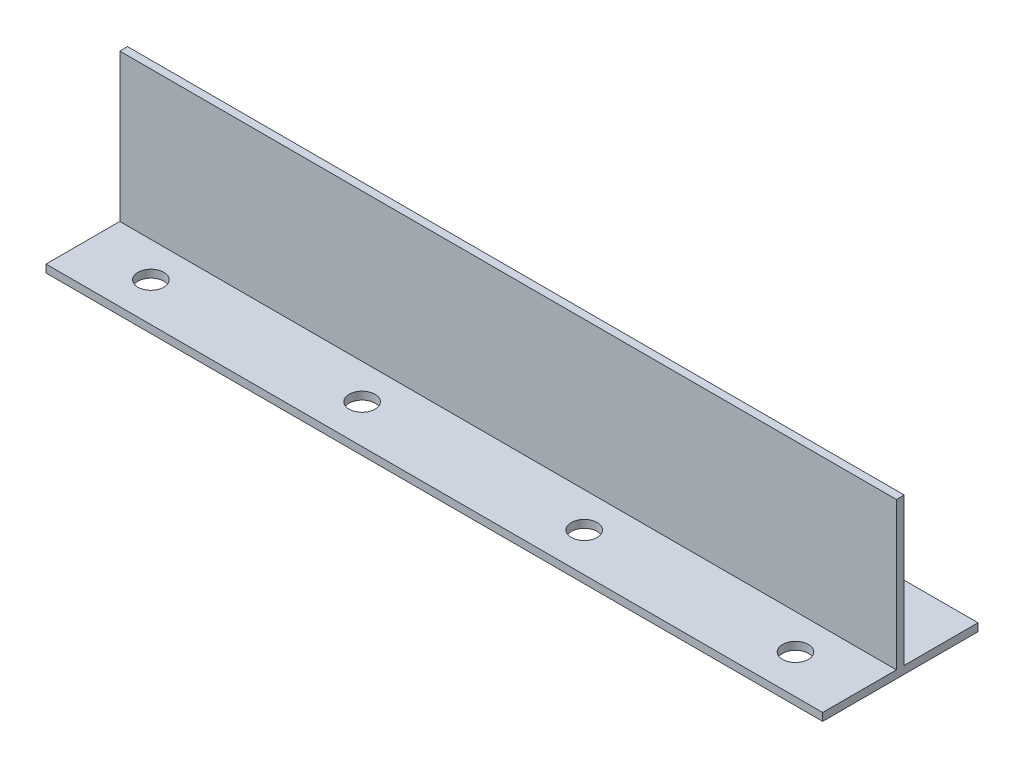
from build123d import *

# Parameters (mm, degrees)
BOSS_EXTRUDE1_DEPTH = 150
SKETCH2_R           = 2.5
CUT_EXTRUDE1_DEPTH  = 154.493688795


with BuildPart() as part:
    # Sketch1 → Boss-Extrude1 (new body)
    with BuildSketch(Plane(origin=(0, 0, 0), x_dir=(0, 0, -1), z_dir=(1, 0, 0))):
        Polygon((-14.25, 0), (15.75, 0), (15.75, 1.5), (1.5, 1.5), (1.5, 30), (0, 30), (0, 1.5), (-14.25, 1.5), align=None)
    extrude(amount=BOSS_EXTRUDE1_DEPTH)

    # Sketch2 → Cut-Extrude1 (cut, through all)
    with BuildSketch(Plane(origin=(0, 1.5, 0), x_dir=(1, 0, 0), z_dir=(0, 1, 0))):
        with Locations(Location((12.75, -6.75, 0), (0, 0, 270))):
            Circle(SKETCH2_R)
        with Locations(Location((12.75, 8.25, 0), (0, 0, 270))):
            Circle(SKETCH2_R)
        with Locations(Location((53.55, 8.25, 0), (0, 0, 270))):
            Circle(SKETCH2_R)
        with Locations(Location((53.55, -6.75, 0), (0, 0, 270))):
            Circle(SKETCH2_R)
        with Locations(Location((96.45, -6.75, 0), (0, 0, 90))):
            Circle(SKETCH2_R)
        with Locations(Location((96.45, 8.25, 0), (0, 0, 90))):
            Circle(SKETCH2_R)
        with Locations(Location((137.25, 8.25, 0), (0, 0, 90))):
            Circle(SKETCH2_R)
        with Locations(Location((137.25, -6.75, 0), (0, 0, 90))):
            Circle(SKETCH2_R)
    extrude(amount=-CUT_EXTRUDE1_DEPTH, mode=Mode.SUBTRACT)


solid = part.part
